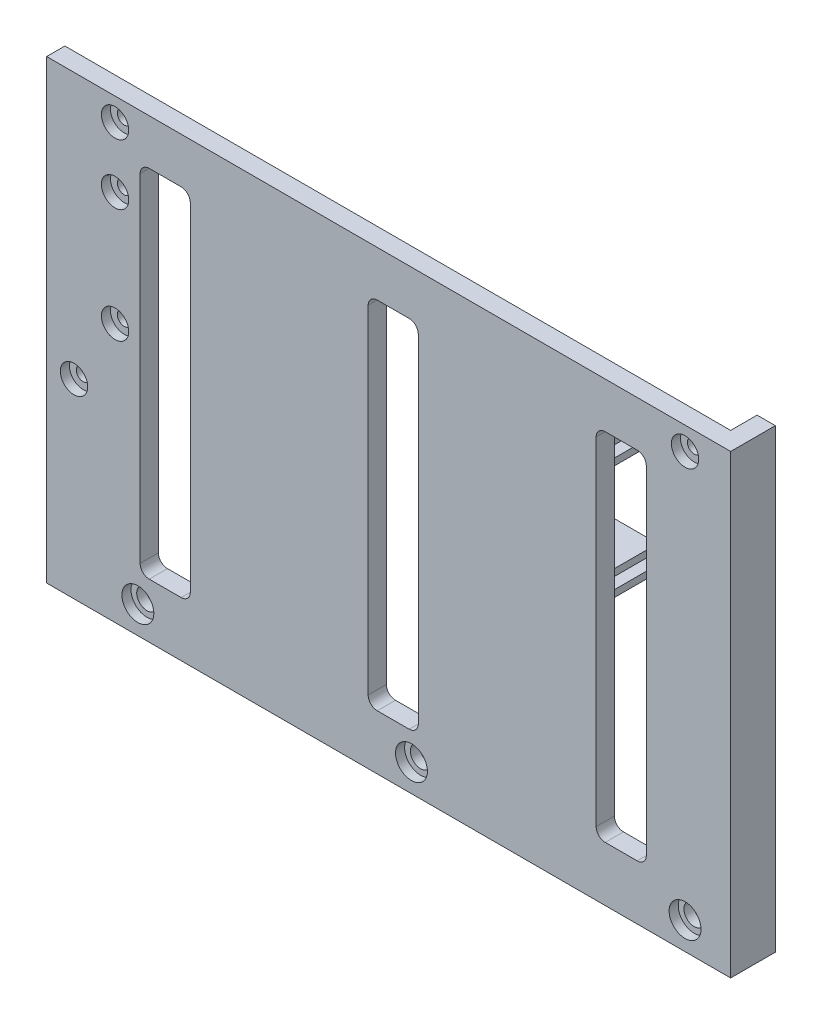
from build123d import *

# Parameters (mm, degrees)
SKETCH1_W                 = 150
SKETCH1_H                 = 4
BOSS_EXTRUDE1_DEPTH       = 100
SKETCH9_W                 = 4
SKETCH9_H                 = 100
BOSS_EXTRUDE4_DEPTH       = 5.8
SKETCH10_W                = 20
SKETCH10_H                = 1.5
BOSS_EXTRUDE5_DEPTH       = 15
LPATTERN1_COUNT           = 2
LPATTERN1_PITCH           = 60
LPATTERN2_COUNT           = 2
LPATTERN2_PITCH           = 25
LPATTERN2_COPY_1_SKETCH_W = 20
LPATTERN2_COPY_1_SKETCH_H = 1.5
LPATTERN2_COPY_1_DEPTH    = 15
LPATTERN3_COUNT           = 2
LPATTERN3_PITCH           = 4
LPATTERN3_COPY_1_SKETCH_W = 20
LPATTERN3_COPY_1_SKETCH_H = 1.5
LPATTERN3_COPY_1_DEPTH    = 15
LPATTERN3_COPY_2_SKETCH_W = 20
LPATTERN3_COPY_2_SKETCH_H = 1.5
LPATTERN3_COPY_2_DEPTH    = 15
LPATTERN3_COPY_3_SKETCH_W = 20
LPATTERN3_COPY_3_SKETCH_H = 1.5
LPATTERN3_COPY_3_DEPTH    = 15
SKETCH12_R                = 3.5
CUT_EXTRUDE2_DEPTH        = 2
CUT_EXTRUDE3_REACH        = 216.198
SKETCH14_R                = 2.25
LPATTERN4_COUNT           = 3
LPATTERN4_PITCH           = 60
SKETCH16_R                = 3
CUT_EXTRUDE4_DEPTH        = 2
CUT_EXTRUDE5_REACH        = 125.072
SKETCH18_R                = 1.5
LPATTERN5_COUNT           = 2
LPATTERN5_PITCH           = 25
SKETCH19_W                = 10
SKETCH19_H                = 7
CUT_EXTRUDE6_DEPTH        = 3
LPATTERN6_COUNT           = 2
LPATTERN6_PITCH           = 55
CUT_EXTRUDE7_REACH        = 127.897
SKETCH20_W                = 11
SKETCH20_H                = 78
FILLET4_R                 = 2
LPATTERN7_COUNT           = 3
LPATTERN7_PITCH           = 50
FILLET4_OF_LPATTERN7_R    = 2
SKETCH21_W                = 8
SKETCH21_H                = 10
CUT_EXTRUDE8_DEPTH        = 3
LPATTERN8_COUNT           = 2
LPATTERN8_PITCH           = 60
SKETCH23_R                = 3
CUT_EXTRUDE9_DEPTH        = 2
CUT_EXTRUDE10_REACH       = 106.668
SKETCH25_R                = 1.5
SKETCH27_R                = 3
CUT_EXTRUDE11_DEPTH       = 2
CUT_EXTRUDE12_REACH       = 131.476
SKETCH29_R                = 1.5
LPATTERN10_COUNT          = 2
LPATTERN10_PITCH          = 125


with BuildPart() as part:
    # Sketch1 → Boss-Extrude1 (new body)
    with BuildSketch(Plane(origin=(0, 0, 0), x_dir=(1, 0, 0), z_dir=(0, 1, 0))):
        with Locations((0, -58)):
            Rectangle(SKETCH1_W, SKETCH1_H)
    extrude(amount=BOSS_EXTRUDE1_DEPTH)

    # Sketch9 → Boss-Extrude4 (add)
    with BuildSketch(Plane(origin=(0, 0, 56), x_dir=(-1, 0, 0), z_dir=(0, 0, -1))):
        with Locations((-73, 50)):
            Rectangle(SKETCH9_W, SKETCH9_H)
    extrude(amount=BOSS_EXTRUDE4_DEPTH)

    # Sketch10 → Boss-Extrude5 (add)
    with BuildSketch(Plane(origin=(0, 0, 56), x_dir=(-1, 0, 0), z_dir=(0, 0, -1))):
        with Locations((-30, 50.75)):
            Rectangle(SKETCH10_W, SKETCH10_H)
    boss_extrude5 = extrude(amount=BOSS_EXTRUDE5_DEPTH)

    # LPattern1: Boss-Extrude5 ×2
    with Locations(*[(-i * LPATTERN1_PITCH, 0, 0) for i in range(1, LPATTERN1_COUNT)]):
        add(boss_extrude5)

    # LPattern2: Boss-Extrude5 ×2
    with Locations(*[(0, i * LPATTERN2_PITCH, 0) for i in range(1, LPATTERN2_COUNT)]):
        add(boss_extrude5)

    # LPattern2 copy 1 sketch → LPattern2 copy 1 (add)
    with BuildSketch(Plane(origin=(-60, 25, 56), x_dir=(-1, 0, 0), z_dir=(0, 0, -1))):
        with Locations((-30, 50.75)):
            Rectangle(LPATTERN2_COPY_1_SKETCH_W, LPATTERN2_COPY_1_SKETCH_H)
    extrude(amount=LPATTERN2_COPY_1_DEPTH)

    # LPattern3: Boss-Extrude5 ×2
    with Locations(*[(0, i * LPATTERN3_PITCH, 0) for i in range(1, LPATTERN3_COUNT)]):
        add(boss_extrude5)

    # LPattern3 copy 1 sketch → LPattern3 copy 1 (add)
    with BuildSketch(Plane(origin=(-60, 4, 56), x_dir=(-1, 0, 0), z_dir=(0, 0, -1))):
        with Locations((-30, 50.75)):
            Rectangle(LPATTERN3_COPY_1_SKETCH_W, LPATTERN3_COPY_1_SKETCH_H)
    extrude(amount=LPATTERN3_COPY_1_DEPTH)

    # LPattern3 copy 2 sketch → LPattern3 copy 2 (add)
    with BuildSketch(Plane(origin=(0, 29, 56), x_dir=(-1, 0, 0), z_dir=(0, 0, -1))):
        with Locations((-30, 50.75)):
            Rectangle(LPATTERN3_COPY_2_SKETCH_W, LPATTERN3_COPY_2_SKETCH_H)
    extrude(amount=LPATTERN3_COPY_2_DEPTH)

    # LPattern3 copy 3 sketch → LPattern3 copy 3 (add)
    with BuildSketch(Plane(origin=(-60, 29, 56), x_dir=(-1, 0, 0), z_dir=(0, 0, -1))):
        with Locations((-30, 50.75)):
            Rectangle(LPATTERN3_COPY_3_SKETCH_W, LPATTERN3_COPY_3_SKETCH_H)
    extrude(amount=LPATTERN3_COPY_3_DEPTH)

    # Sketch12 → Cut-Extrude2 (cut)
    with BuildSketch(Plane(origin=(118.42090966, 9.556382744, 60), x_dir=(1, 0, 0), z_dir=(0, 0, 1))):
        with Locations((-53.42090966, -3.556382744)):
            Circle(SKETCH12_R)
    cut_extrude2 = extrude(amount=-CUT_EXTRUDE2_DEPTH, mode=Mode.SUBTRACT)

    # Sketch14 → Cut-Extrude3 (cut, up to next)
    with BuildSketch(Plane(origin=(118.42090966, 9.556382744, 58), x_dir=(1, 0, 0), z_dir=(0, 0, 1)), mode=Mode.PRIVATE) as cut_extrude3_sk1:
        with Locations((-53.42090966, -3.556382744)):
            Circle(SKETCH14_R)
    cut_extrude3_tool1 = extrude(cut_extrude3_sk1.sketch, amount=-CUT_EXTRUDE3_REACH, mode=Mode.PRIVATE) & part.part
    cut_extrude3 = cut_extrude3_tool1.solids().sort_by_distance((65, 6, 58))[0]
    add(cut_extrude3, mode=Mode.SUBTRACT)

    # LPattern4: Cut-Extrude2, Cut-Extrude3 ×3
    with Locations(*[(-i * LPATTERN4_PITCH, 0, 0) for i in range(1, LPATTERN4_COUNT)]):
        add(cut_extrude2, mode=Mode.SUBTRACT)
        add(cut_extrude3, mode=Mode.SUBTRACT)

    # Sketch16 → Cut-Extrude4 (cut)
    with BuildSketch(Plane(origin=(-5.380870304, 91.632593669, 60), x_dir=(1, 0, 0), z_dir=(0, 0, 1))):
        with Locations((-54.619129696, -9.882593669)):
            Circle(SKETCH16_R)
    cut_extrude4 = extrude(amount=-CUT_EXTRUDE4_DEPTH, mode=Mode.SUBTRACT)

    # Sketch18 → Cut-Extrude5 (cut, up to next)
    with BuildSketch(Plane(origin=(-5.380870304, 91.632593669, 58), x_dir=(1, 0, 0), z_dir=(0, 0, 1)), mode=Mode.PRIVATE) as cut_extrude5_sk1:
        with Locations((-54.619129696, -9.882593669)):
            Circle(SKETCH18_R)
    cut_extrude5_tool1 = extrude(cut_extrude5_sk1.sketch, amount=-CUT_EXTRUDE5_REACH, mode=Mode.PRIVATE) & part.part
    cut_extrude5 = cut_extrude5_tool1.solids().sort_by_distance((-60, 81.75, 58))[0]
    add(cut_extrude5, mode=Mode.SUBTRACT)

    # LPattern5: Cut-Extrude4, Cut-Extrude5 ×2
    with Locations(*[(0, -i * LPATTERN5_PITCH, 0) for i in range(1, LPATTERN5_COUNT)]):
        add(cut_extrude4, mode=Mode.SUBTRACT)
        add(cut_extrude5, mode=Mode.SUBTRACT)

    # Sketch19 → Cut-Extrude6 (cut)
    with BuildSketch(Plane(origin=(0, 0, 56), x_dir=(-1, 0, 0), z_dir=(0, 0, -1))):
        with Locations((67.5, 86.5)):
            Rectangle(SKETCH19_W, SKETCH19_H)
    cut_extrude6 = extrude(amount=-CUT_EXTRUDE6_DEPTH, mode=Mode.SUBTRACT)

    # LPattern6: Cut-Extrude6 ×2
    with Locations(*[(0, -i * LPATTERN6_PITCH, 0) for i in range(1, LPATTERN6_COUNT)]):
        add(cut_extrude6, mode=Mode.SUBTRACT)

    # Sketch20 → Cut-Extrude7 (cut, up to next)
    with BuildSketch(Plane(origin=(0, 0, 56), x_dir=(-1, 0, 0), z_dir=(0, 0, -1)), mode=Mode.PRIVATE) as cut_extrude7_sk1:
        with Locations((49, 51)):
            Rectangle(SKETCH20_W, SKETCH20_H)
    cut_extrude7_tool1 = extrude(cut_extrude7_sk1.sketch, amount=-CUT_EXTRUDE7_REACH, mode=Mode.PRIVATE) & part.part
    cut_extrude7 = cut_extrude7_tool1.solids().sort_by_distance((-49, 51, 56))[0]
    add(cut_extrude7, mode=Mode.SUBTRACT)

    # Fillet4
    fillet4_edges = [part.edges().sort_by_distance(p)[0] for p in [
        (-43.5, 12, 58),
        (-43.5, 90, 58),
        (-54.5, 90, 58),
        (-54.5, 12, 58),
    ]]
    fillet(fillet4_edges, radius=FILLET4_R)

    # LPattern7: Cut-Extrude7 ×3
    with Locations(*[(i * LPATTERN7_PITCH, 0, 0) for i in range(1, LPATTERN7_COUNT)]):
        add(cut_extrude7, mode=Mode.SUBTRACT)

    # Fillet4 of LPattern7
    fillet4_of_lpattern7_edges = [part.edges().sort_by_distance(p)[0] for p in [
        (6.5, 12, 58),
        (6.5, 90, 58),
        (-4.5, 90, 58),
        (-4.5, 12, 58),
        (56.5, 12, 58),
        (56.5, 90, 58),
        (45.5, 90, 58),
        (45.5, 12, 58),
    ]]
    fillet(fillet4_of_lpattern7_edges, radius=FILLET4_OF_LPATTERN7_R)

    # Sketch21 → Cut-Extrude8 (cut)
    with BuildSketch(Plane(origin=(0, 0, 56), x_dir=(-1, 0, 0), z_dir=(0, 0, -1))):
        with Locations((29, 88.538707867)):
            Rectangle(SKETCH21_W, SKETCH21_H)
    cut_extrude8 = extrude(amount=-CUT_EXTRUDE8_DEPTH, mode=Mode.SUBTRACT)

    # LPattern8: Cut-Extrude8 ×2
    with Locations(*[(i * LPATTERN8_PITCH, 0, 0) for i in range(1, LPATTERN8_COUNT)]):
        add(cut_extrude8, mode=Mode.SUBTRACT)

    # Sketch23 → Cut-Extrude9 (cut)
    with BuildSketch(Plane(origin=(-14.094781426, 47.764709476, 60), x_dir=(1, 0, 0), z_dir=(0, 0, 1))):
        with Locations((-54.905218574, -6.014709476)):
            Circle(SKETCH23_R)
    extrude(amount=-CUT_EXTRUDE9_DEPTH, mode=Mode.SUBTRACT)

    # Sketch25 → Cut-Extrude10 (cut, up to next)
    with BuildSketch(Plane(origin=(-14.094781426, 47.764709476, 58), x_dir=(1, 0, 0), z_dir=(0, 0, 1)), mode=Mode.PRIVATE) as cut_extrude10_sk1:
        with Locations((-54.905218574, -6.014709476)):
            Circle(SKETCH25_R)
    cut_extrude10_tool1 = extrude(cut_extrude10_sk1.sketch, amount=-CUT_EXTRUDE10_REACH, mode=Mode.PRIVATE) & part.part
    add(cut_extrude10_tool1.solids().sort_by_distance((-69, 41.75, 58))[0], mode=Mode.SUBTRACT)

    # Sketch27 → Cut-Extrude11 (cut)
    with BuildSketch(Plane(origin=(-5.434124332, 100.026831424, 60), x_dir=(1, 0, 0), z_dir=(0, 0, 1))):
        with Locations((-54.565875668, -5.026831424)):
            Circle(SKETCH27_R)
    cut_extrude11 = extrude(amount=-CUT_EXTRUDE11_DEPTH, mode=Mode.SUBTRACT)

    # Sketch29 → Cut-Extrude12 (cut, up to next)
    with BuildSketch(Plane(origin=(-5.434124332, 100.026831424, 58), x_dir=(1, 0, 0), z_dir=(0, 0, 1)), mode=Mode.PRIVATE) as cut_extrude12_sk1:
        with Locations((-54.565875668, -5.026831424)):
            Circle(SKETCH29_R)
    cut_extrude12_tool1 = extrude(cut_extrude12_sk1.sketch, amount=-CUT_EXTRUDE12_REACH, mode=Mode.PRIVATE) & part.part
    cut_extrude12 = cut_extrude12_tool1.solids().sort_by_distance((-60, 95, 58))[0]
    add(cut_extrude12, mode=Mode.SUBTRACT)

    # LPattern10: Cut-Extrude11, Cut-Extrude12 ×2
    with Locations(*[(i * LPATTERN10_PITCH, 0, 0) for i in range(1, LPATTERN10_COUNT)]):
        add(cut_extrude11, mode=Mode.SUBTRACT)
        add(cut_extrude12, mode=Mode.SUBTRACT)


solid = part.part
